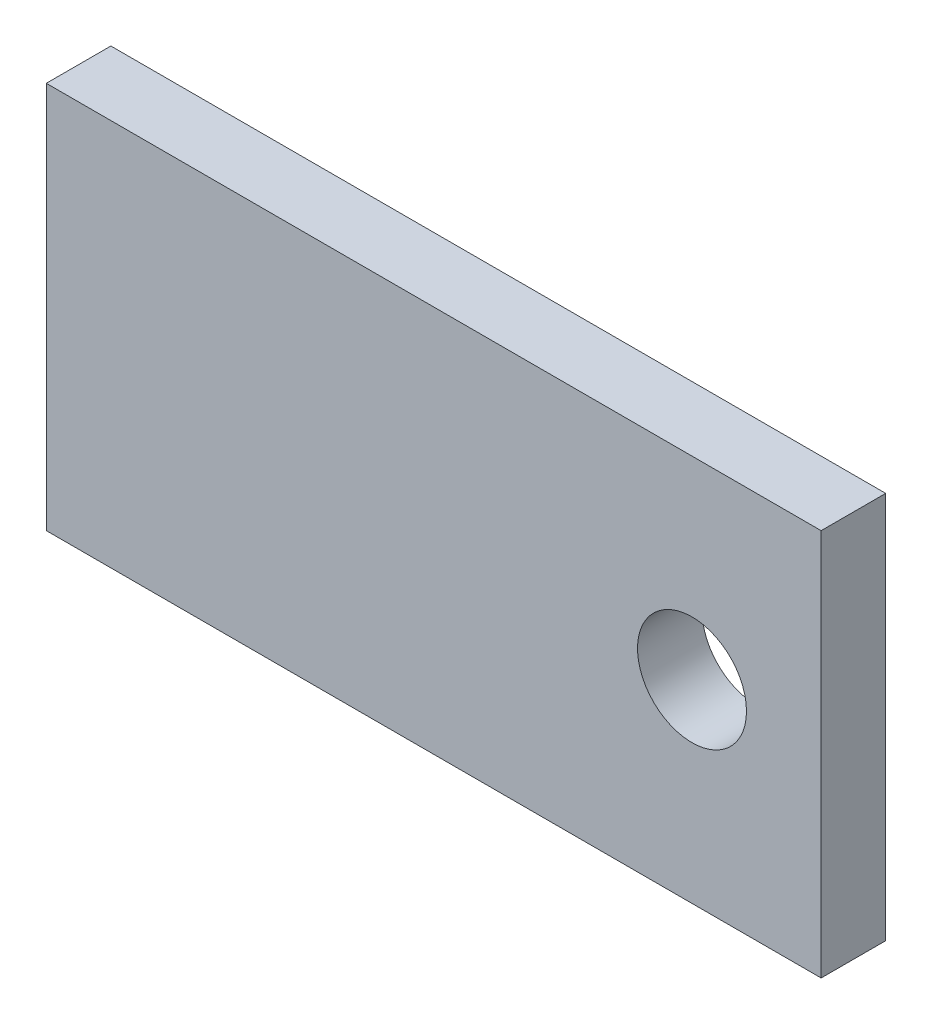
from build123d import *

# Parameters (mm, degrees)
SKETCH1_W                        = 76.2
SKETCH1_H                        = 38.1
EXTRUDE1_DEPTH                   = 3.175
F_27_64_0_42188_DIAMETER_HOLE1_D = 10.715752


with BuildPart() as part:
    # Sketch1 → Extrude1 (new, symmetric)
    with BuildSketch(Plane.XY):
        Rectangle(SKETCH1_W, SKETCH1_H)
    extrude(amount=EXTRUDE1_DEPTH, both=True)

    # 27/64 (0.42188) Diameter Hole1 (through all)
    with Locations(Plane(origin=(25.4, 0, 3.175), x_dir=(1, 0, 0), z_dir=(0, 0, 1))):
        with Locations((0, 0)):
            Hole(F_27_64_0_42188_DIAMETER_HOLE1_D / 2)


solid = part.part
